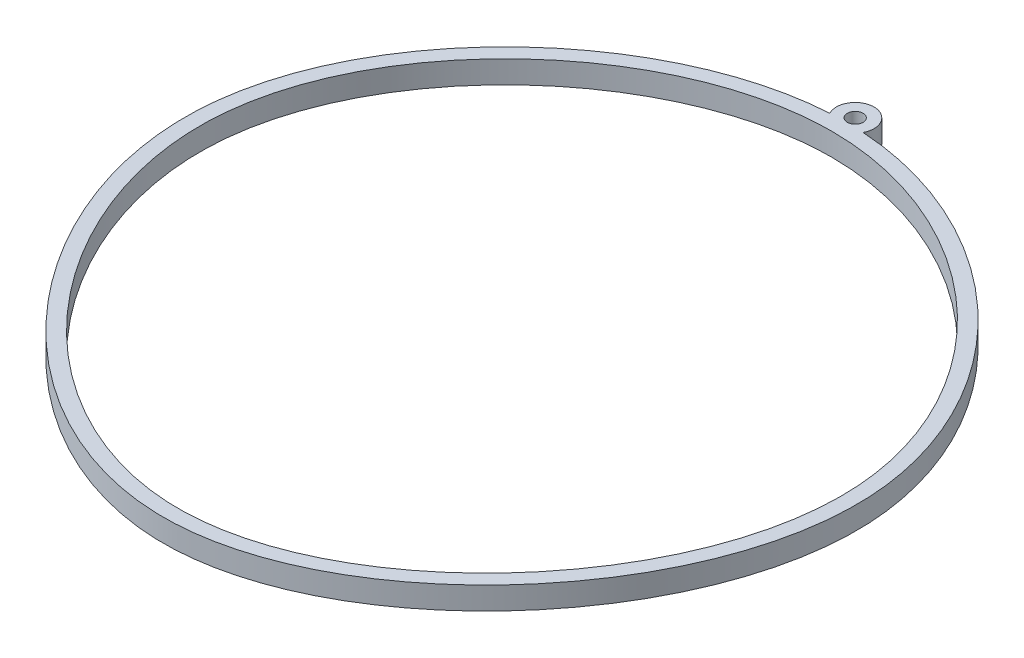
from build123d import *

# Parameters (mm, degrees)
SKETCH1_R           = 1.05
BOSS_EXTRUDE1_DEPTH = 3


with BuildPart() as part:
    # Sketch1 → Boss-Extrude1 (new body)
    # profile 1 of 2: a face of its own
    with BuildSketch(Plane(origin=(0, 0, 0), x_dir=(1, 0, 0), z_dir=(0, 1, 0))):
        with BuildLine():
            add(Edge.make_bspline(
                [(0, 41.087), (0.737095875, 41.087), (1.47419175, 41.064164352), (2.210482646, 41.019195875)],
                knots=[0, 0, 0, 0, 0.00812337, 0.00812337, 0.00812337, 0.00812337], degree=3))
            ThreePointArc((2.210482646, 41.019195875), (0, 44.687), (-2.210482646, 41.019195875))
            add(Edge.make_bspline(
                [(-2.210482646, 41.019195875), (-1.47419175, 41.064164352), (-0.737095875, 41.087), (0, 41.087)],
                knots=[0.99187663, 0.99187663, 0.99187663, 0.99187663, 1, 1, 1, 1], degree=3))
        make_face()
        with Locations(Location((0, 42.187, 0), (0, 0, 270))):
            Circle(SKETCH1_R, mode=Mode.SUBTRACT)
    # profile 2 of 2: a face of its own
    with BuildSketch(Plane(origin=(0, 0, 0), x_dir=(1, 0, 0), z_dir=(0, 1, 0))):
        with BuildLine():
            add(Edge.make_bspline(
                [(0, 41.087), (21.581198156, 41.087), (66.950044325, -0.065731266), (0, -75.835355827), (-66.950044325, -0.065731266), (-21.581198156, 41.087), (0, 41.087)],
                knots=[0, 0, 0, 0, 0.237841603, 0.5, 0.762158397, 1, 1, 1, 1], degree=3))
        make_face()
        with BuildLine():
            add(Edge.make_bspline(
                [(0, 39.087), (20.582849429, 39.087), (63.956628169, -0.067804228), (0, -72.839890093), (-63.956628169, -0.067804228), (-20.582849429, 39.087), (0, 39.087)],
                knots=[0, 0, 0, 0, 0.237272956, 0.5, 0.762727044, 1, 1, 1, 1], degree=3))
        make_face(mode=Mode.SUBTRACT)
    extrude(amount=BOSS_EXTRUDE1_DEPTH)


solid = part.part
